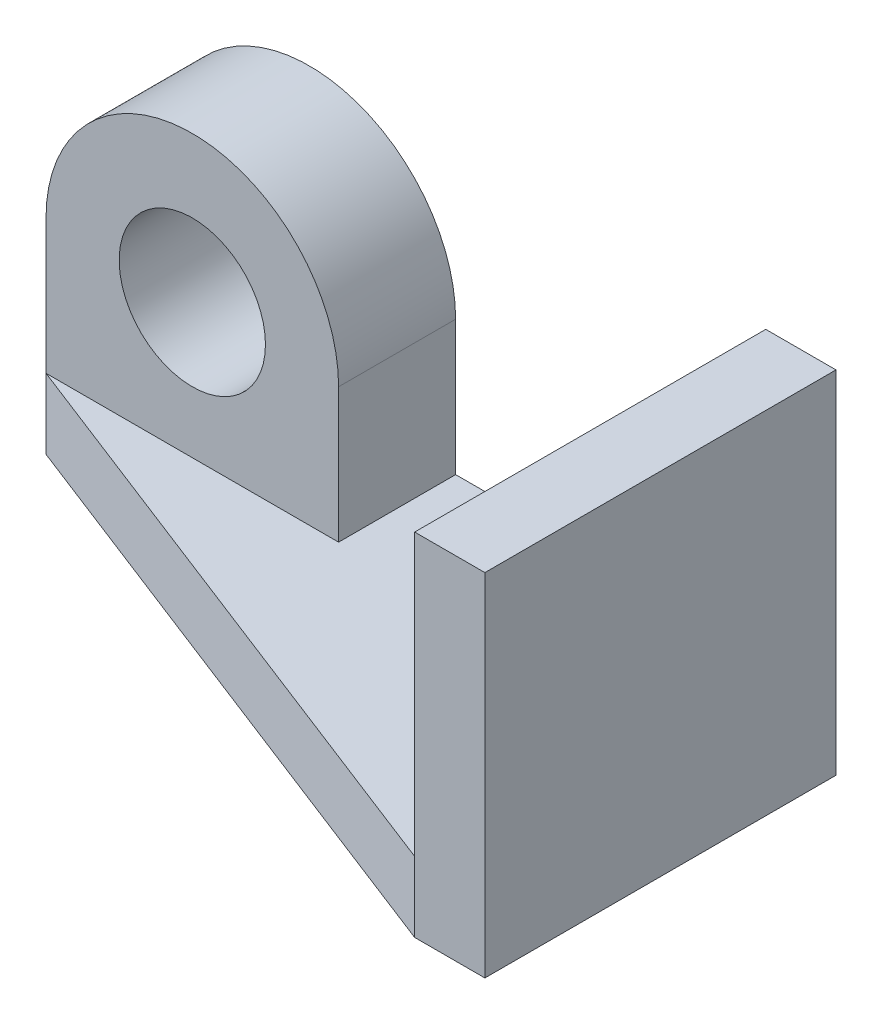
from build123d import *

# Parameters (mm, degrees)
BOSS_EXTRUDE1_DEPTH = 60
CUT_EXTRUDE1_DEPTH  = 12
SKETCH4_W           = 50
SKETCH4_H           = 20
BOSS_EXTRUDE3_DEPTH = 23
BOSS_EXTRUDE4_DEPTH = 20
SKETCH6_R           = 12.5
CUT_EXTRUDE3_DEPTH  = 20


with BuildPart() as part:
    # Sketch1 → Boss-Extrude1 (new body)
    with BuildSketch(Plane.XY):
        Polygon((0, 0), (115, 0), (115, 60), (103, 60), (103, 12), (0, 12), align=None)
    extrude(amount=BOSS_EXTRUDE1_DEPTH)

    # Sketch2 → Cut-Extrude1 (cut)
    with BuildSketch(Plane(origin=(0, 12, 0), x_dir=(1, 0, 0), z_dir=(0, 1, 0))):
        Polygon((0, -20), (103, -60), (0, -60), align=None)
    extrude(amount=-CUT_EXTRUDE1_DEPTH, mode=Mode.SUBTRACT)

    # Sketch4 → Boss-Extrude3 (add)
    with BuildSketch(Plane(origin=(0, 12, 0), x_dir=(1, 0, 0), z_dir=(0, 1, 0))):
        with Locations((25, -10)):
            Rectangle(SKETCH4_W, SKETCH4_H)
    extrude(amount=BOSS_EXTRUDE3_DEPTH)

    # Sketch5 → Boss-Extrude4 (add)
    with BuildSketch(Plane.XY.offset(20)):
        with BuildLine():
            Line((0, 35), (50, 35))
            ThreePointArc((50, 35), (25, 60), (0, 35))
        make_face()
    extrude(amount=-BOSS_EXTRUDE4_DEPTH)

    # Sketch6 → Cut-Extrude3 (cut)
    with BuildSketch(Plane.XY.offset(20)):
        with Locations((25, 35)):
            Circle(SKETCH6_R)
    extrude(amount=-CUT_EXTRUDE3_DEPTH, mode=Mode.SUBTRACT)


solid = part.part
